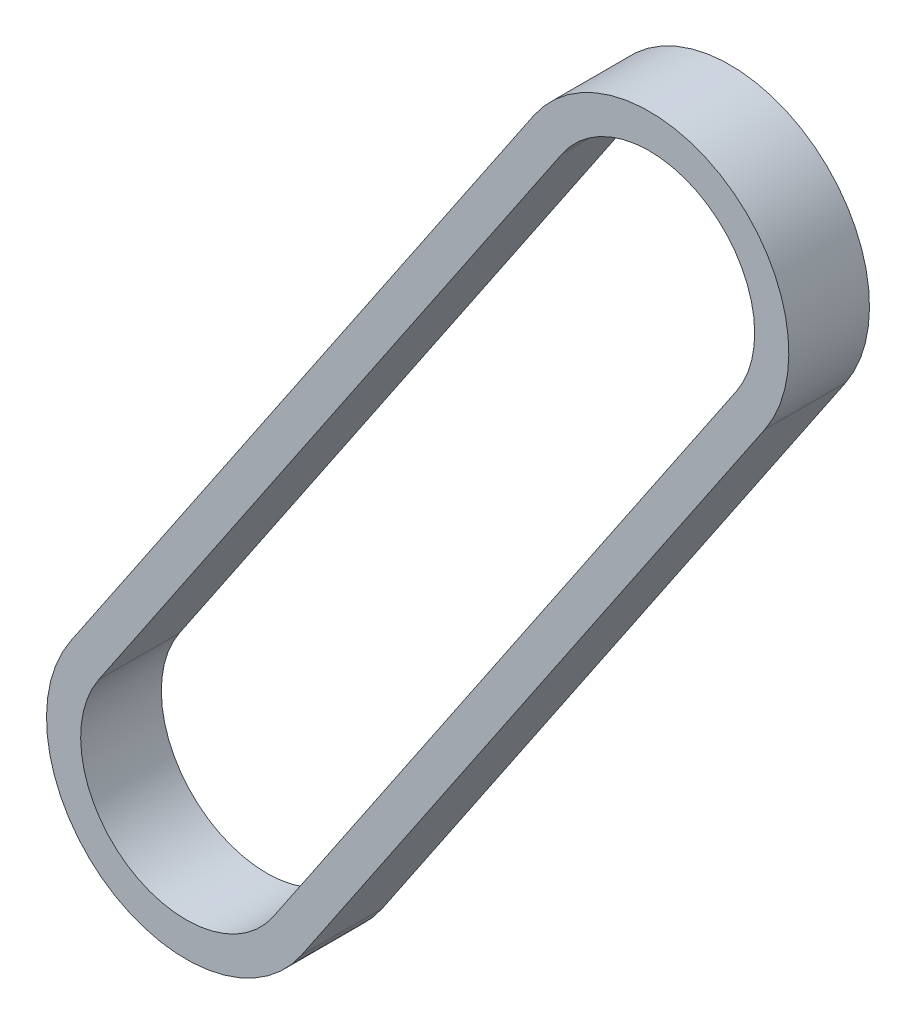
from build123d import *

# Parameters (mm, degrees)
EXTRUDE_THIN1_DEPTH = 4.500000017


with BuildPart() as part:
    # Sketch2 → Extrude-Thin1 (new, symmetric)
    with BuildSketch(Plane.XY):
        with BuildLine():
            Line((12.902389413, -8.702771547), (-38.787444436, -85.33610168))
            ThreePointArc((-38.787444436, -85.33610168), (-60.392605396, -89.535719547), (-64.592223262, -67.930558587))
            Line((-64.592223262, -67.930558587), (-12.902389413, 8.702771547))
            ThreePointArc((-12.902389413, 8.702771547), (8.702771547, 12.902389413), (12.902389413, -8.702771547))
        make_face()
        with BuildLine():
            Line((9.743756261, -6.572246584), (-41.946077588, -83.205576718))
            ThreePointArc((-41.946077588, -83.205576718), (-58.262080434, -86.377086395), (-61.433590111, -70.061083549))
            Line((-61.433590111, -70.061083549), (-9.743756261, 6.572246584))
            ThreePointArc((-9.743756261, 6.572246584), (6.572246584, 9.743756261), (9.743756261, -6.572246584))
        make_face(mode=Mode.SUBTRACT)
    extrude(amount=EXTRUDE_THIN1_DEPTH, both=True)


solid = part.part
